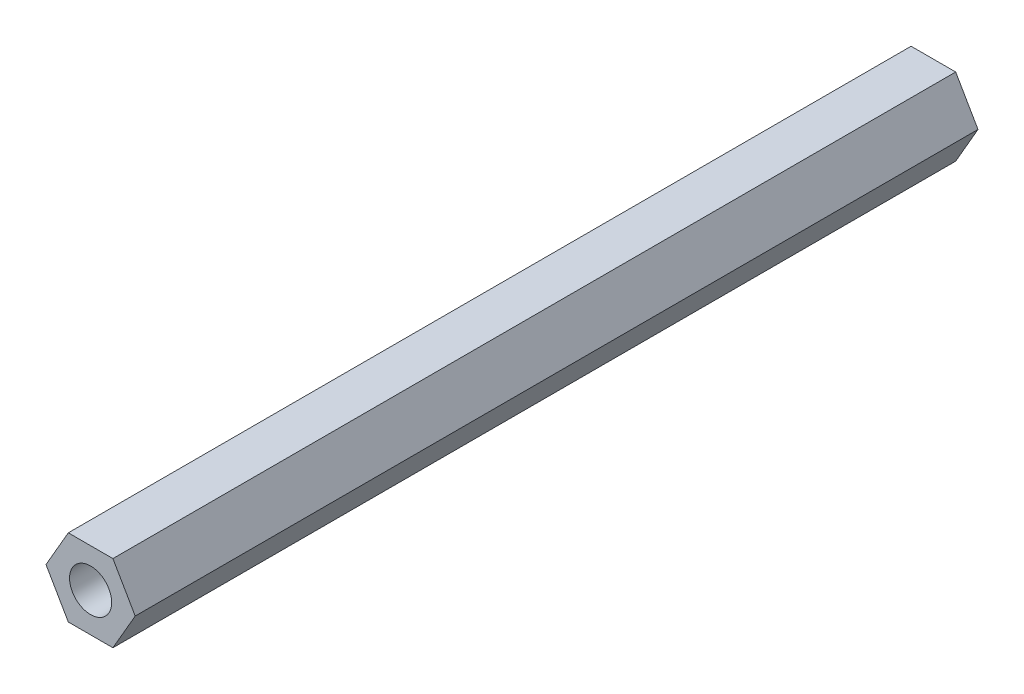
from build123d import *

# Parameters (mm, degrees)
SKETCH1_R           = 1.5
BOSS_EXTRUDE1_DEPTH = 60


with BuildPart() as part:
    # Sketch1 → Boss-Extrude1 (new body)
    with BuildSketch(Plane.XY):
        Polygon((3.175426481, 0), (1.58771324, 2.75), (-1.58771324, 2.75), (-3.175426481, 0), (-1.58771324, -2.75), (1.58771324, -2.75), align=None)
        Circle(SKETCH1_R, mode=Mode.SUBTRACT)
    extrude(amount=BOSS_EXTRUDE1_DEPTH)


solid = part.part
